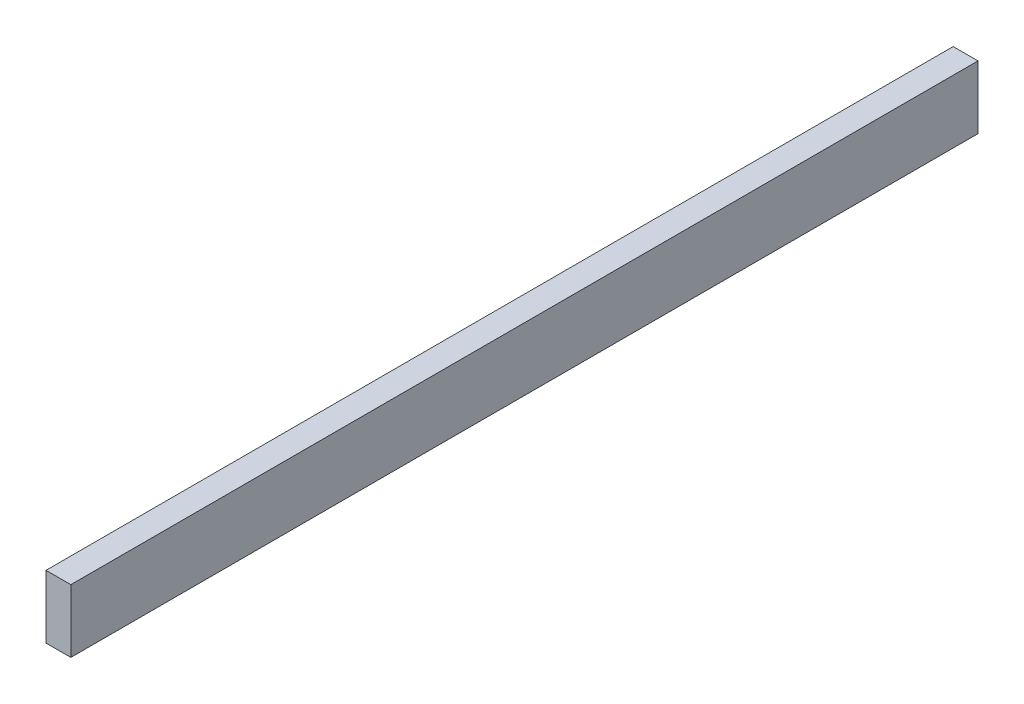
from build123d import *

# Parameters (mm, degrees)
SKETCH1_W           = 18
SKETCH1_H           = 45.72
BOSS_EXTRUDE1_DEPTH = 552
SKETCH2_W           = 18
SKETCH2_H           = 45.72
BOSS_EXTRUDE2_DEPTH = 106


with BuildPart() as part:
    # Sketch1 → Boss-Extrude1 (new body)
    with BuildSketch(Plane.XY):
        with Locations((-203, 0)):
            Rectangle(SKETCH1_W, SKETCH1_H)
    extrude(amount=-BOSS_EXTRUDE1_DEPTH)

    # Sketch2 → Boss-Extrude2 (add)
    with BuildSketch(Plane(origin=(0, 0, -552), x_dir=(-1, 0, 0), z_dir=(0, 0, -1))):
        with Locations((203, 0)):
            Rectangle(SKETCH2_W, SKETCH2_H)
    extrude(amount=BOSS_EXTRUDE2_DEPTH)


solid = part.part
